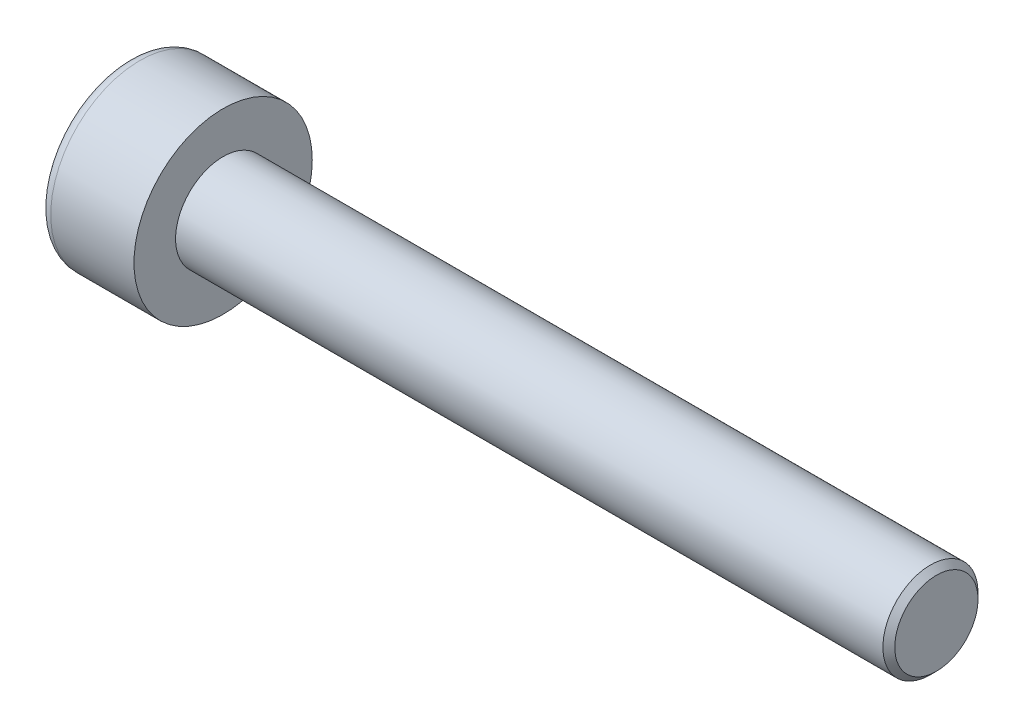
from build123d import *

# Parameters (mm, degrees)
SKETCH1_R           = 1.5
BASEHEAD_DEPTH      = 1.6
SKETCH2_R           = 0.8
BASEBODY_DEPTH      = 12
HEXAGONSOCKET_DEPTH = 0.7
TOPFILLET_R         = 0.2
CHAMFER1_SIZE       = 0.1


with BuildPart() as part:
    # Sketch1 → BaseHead (new body)
    with BuildSketch(Plane(origin=(0, 0, 0), x_dir=(0, 0, -1), z_dir=(1, 0, 0))):
        Circle(SKETCH1_R)
    extrude(amount=BASEHEAD_DEPTH)

    # Sketch2 → BaseBody (add)
    with BuildSketch(Plane(origin=(1.6, 0, 0), x_dir=(0, 0, -1), z_dir=(1, 0, 0))):
        Circle(SKETCH2_R)
    extrude(amount=BASEBODY_DEPTH)

    # Sketch3 → HexagonSocket (cut)
    with BuildSketch(Plane(origin=(0, 0, 0), x_dir=(0, 0, -1), z_dir=(1, 0, 0))):
        Polygon((0.866025404, 0), (0.433012702, 0.75), (-0.433012702, 0.75), (-0.866025404, 0), (-0.433012702, -0.75), (0.433012702, -0.75), align=None)
    extrude(amount=HEXAGONSOCKET_DEPTH, mode=Mode.SUBTRACT)

    # Sketch4 → Cut-Revolve1 (revolve, cut)
    with BuildSketch(Plane(origin=(-4.19613823, 0.75, 0), x_dir=(-1, 0, 0), z_dir=(0, 0, 1)), mode=Mode.PRIVATE) as cut_revolve1_sk:
        Polygon((-4.89613823, 1.5), (-5.329150931, 0.75), (-4.89613823, 0.75), align=None)
    revolve(cut_revolve1_sk.sketch.rotate(Axis((0.838992387, 0, 0), (-1, 0, 0)), 90), axis=Axis((0.838992387, 0, 0), (-1, 0, 0)), mode=Mode.SUBTRACT)

    # TopFillet
    topfillet_edges = [part.edges().sort_by_distance(p)[0] for p in [
        (0, 0, 1.5),
    ]]
    fillet(topfillet_edges, radius=TOPFILLET_R)

    # Chamfer1
    chamfer1_edges = [part.edges().sort_by_distance(p)[0] for p in [
        (13.6, 0, 0.8),
    ]]
    chamfer(chamfer1_edges, length=CHAMFER1_SIZE)


solid = part.part
